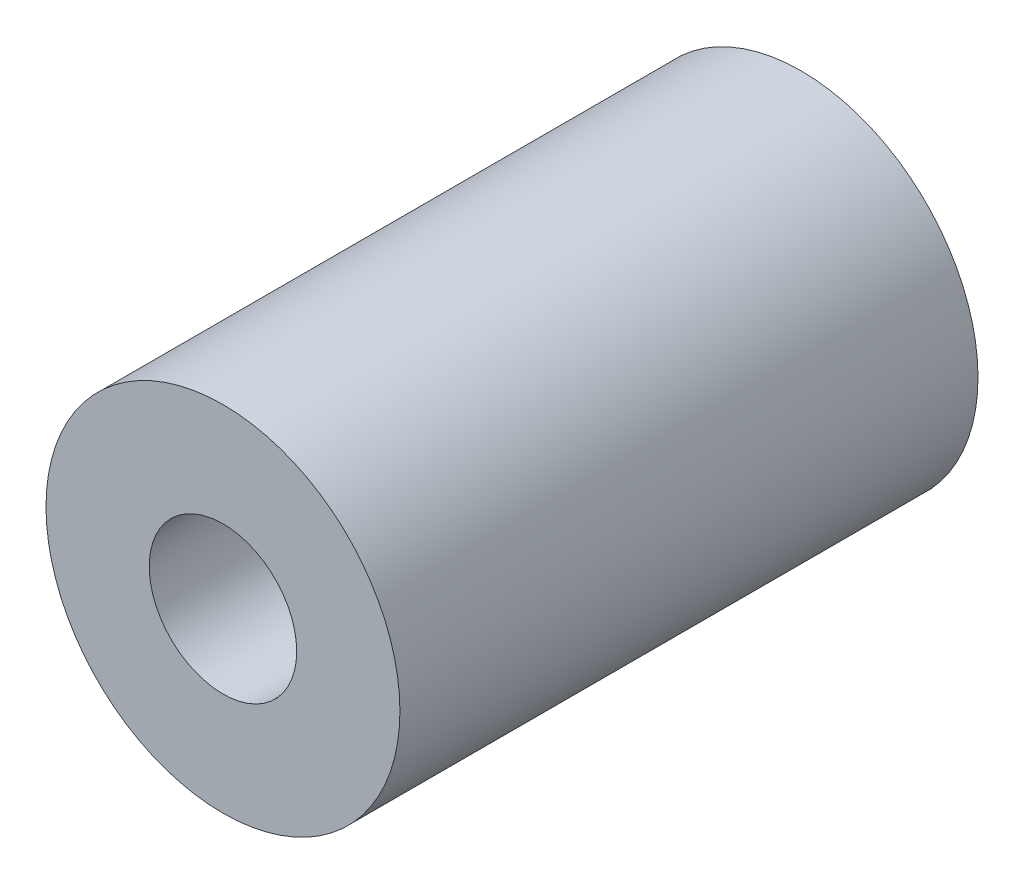
from build123d import *

# Parameters (mm, degrees)
SKETCH_1_R          = 30
EXTRUDE_1_DEPTH     = 98
SKETCH_2_R          = 12.5
CUT_EXTRUDE_1_DEPTH = 32
SKETCH_3_R          = 17.5
CUT_EXTRUDE_2_DEPTH = 30


with BuildPart() as part:
    # 草图1 → 凸台-拉伸1 (new body)
    with BuildSketch(Plane.XY):
        Circle(SKETCH_1_R)
    extrude(amount=EXTRUDE_1_DEPTH)

    # 草图2 → 切除-拉伸1 (cut)
    with BuildSketch(Plane.XY.offset(98)):
        Circle(SKETCH_2_R)
    extrude(amount=-CUT_EXTRUDE_1_DEPTH, mode=Mode.SUBTRACT)

    # 草图3 → 切除-拉伸2 (cut)
    with BuildSketch(Plane(origin=(0, 0, 0), x_dir=(-1, 0, 0), z_dir=(0, 0, -1))):
        Circle(SKETCH_3_R)
    extrude(amount=-CUT_EXTRUDE_2_DEPTH, mode=Mode.SUBTRACT)


solid = part.part
